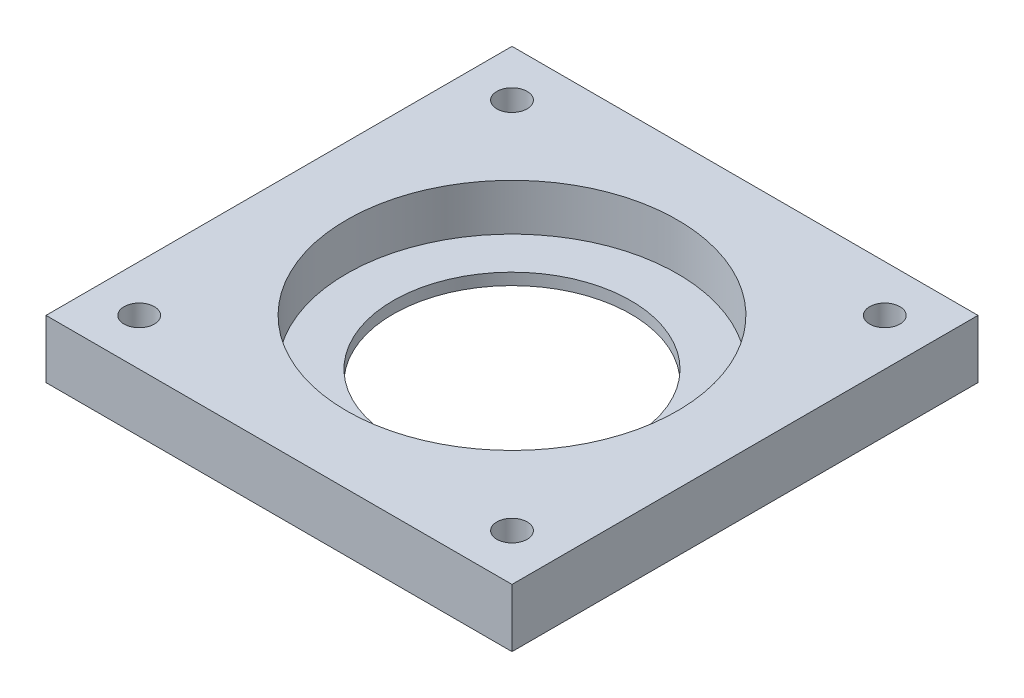
from build123d import *

# Parameters (mm, degrees)
CROQUIS1_W              = 100
CROQUIS1_H              = 100
SALIENTE_EXTRUIR1_DEPTH = 12.5
CROQUIS2_R              = 35.5
CORTAR_EXTRUIR1_DEPTH   = 10
CROQUIS3_R              = 25.5
CORTAR_EXTRUIR2_DEPTH   = 72.414284285
CORTAR_EXTRUIR3_DEPTH   = 72.807033082
MATRIZC1_COUNT          = 4


with BuildPart() as part:
    # Croquis1 → Saliente-Extruir1 (new body)
    with BuildSketch(Plane(origin=(0, 0, 0), x_dir=(1, 0, 0), z_dir=(0, 1, 0))):
        Rectangle(CROQUIS1_W, CROQUIS1_H)
    extrude(amount=SALIENTE_EXTRUIR1_DEPTH)

    # Croquis2 → Cortar-Extruir1 (cut)
    with BuildSketch(Plane(origin=(0, 12.5, 0), x_dir=(1, 0, 0), z_dir=(0, 1, 0))):
        with Locations(Location((0, 0, 0), (0, 0, 270))):
            Circle(CROQUIS2_R)
    extrude(amount=-CORTAR_EXTRUIR1_DEPTH, mode=Mode.SUBTRACT)

    # Croquis3 → Cortar-Extruir2 (cut, through all)
    with BuildSketch(Plane(origin=(0, 2.5, 0), x_dir=(1, 0, 0), z_dir=(0, 1, 0))):
        with Locations(Location((0, 0, 0), (0, 0, 270))):
            Circle(CROQUIS3_R)
    extrude(amount=-CORTAR_EXTRUIR2_DEPTH, mode=Mode.SUBTRACT)

    # Croquis4 → Cortar-Extruir3 (cut, through all)
    with BuildSketch(Plane(origin=(0, 12.5, 0), x_dir=(1, 0, 0), z_dir=(0, 1, 0))):
        with BuildLine():
            ThreePointArc((36.75, 40), (37.701902961, 37.701902961), (40, 36.75))
            Line((40, 36.75), (40, 40))
            Line((40, 40), (36.75, 40))
        make_face()
        with BuildLine():
            Line((40, 40), (40, 36.75))
            ThreePointArc((40, 36.75), (42.298097039, 37.701902961), (43.25, 40))
            ThreePointArc((43.25, 40), (40, 43.25), (36.75, 40))
            Line((36.75, 40), (40, 40))
        make_face()
    cortar_extruir3 = extrude(amount=-CORTAR_EXTRUIR3_DEPTH, mode=Mode.SUBTRACT)

    # MatrizC1: Cortar-Extruir3 ×4 about axis
    matrizc1_axis = Axis((0, 0, 0), (0, 1, 0))
    for i in range(1, MATRIZC1_COUNT):
        add(cortar_extruir3.rotate(matrizc1_axis, i * 360 / MATRIZC1_COUNT), mode=Mode.SUBTRACT)


solid = part.part
